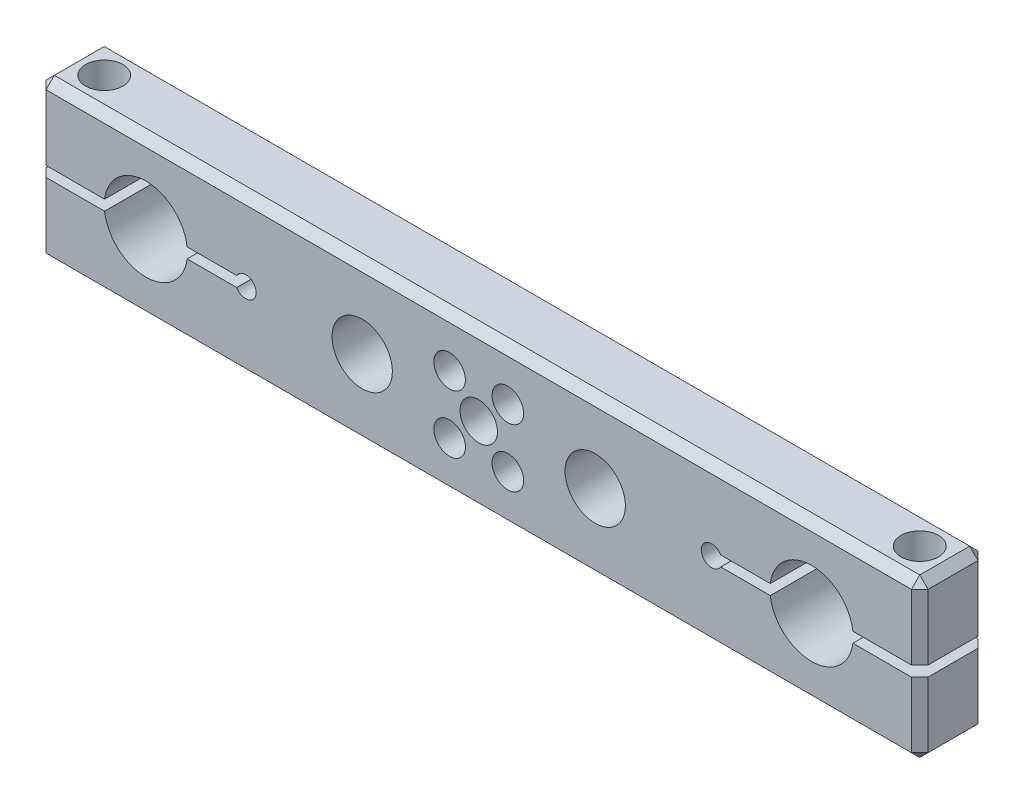
from build123d import *

# Parameters (mm, degrees)
SKETCH_1_W                = 212
SKETCH_1_H                = 38
EXTRUDE_1_DEPTH           = 8
SKETCH_2_R                = 10
CUT_EXTRUDE_1_DEPTH       = 109.87148387
SKETCH_3_W                = 50
SKETCH_3_H                = 2.5
CUT_EXTRUDE_2_DEPTH       = 109.87148387
SKETCH_4_R                = 6
CUT_EXTRUDE_3_DEPTH       = 4
SKETCH_5_R                = 4.5
CUT_EXTRUDE_4_DEPTH       = 109.87148387
HOLE_WIZARD_1_D           = 4.5
HOLE_WIZARD_1_CBORE_D     = 7.6
HOLE_WIZARD_1_CBORE_DEPTH = 10
SKETCH_8_R                = 7.25
CUT_EXTRUDE_5_DEPTH       = 109.87148387
SKETCH_9_R                = 4.5
CUT_EXTRUDE_6_DEPTH       = 17.75
M8X1_25_1_D               = 6.8
CHAMFER_1_SIZE            = 2
SKETCH_13_R               = 2.5
CUT_EXTRUDE_7_DEPTH       = 109.87148387


with BuildPart() as part:
    # 草图1 → 凸台-拉伸1 (new, symmetric)
    with BuildSketch(Plane.XY):
        Rectangle(SKETCH_1_W, SKETCH_1_H)
    extrude(amount=EXTRUDE_1_DEPTH, both=True)

    # 草图2 → 切除-拉伸1 (cut, through all)
    with BuildSketch(Plane.XY.offset(8)):
        with Locations((-80, 0)):
            Circle(SKETCH_2_R)
        with Locations(Location((80, 0, 0), (0, 0, 180))):
            Circle(SKETCH_2_R)
    extrude(amount=-CUT_EXTRUDE_1_DEPTH, mode=Mode.SUBTRACT)

    # 草图3 → 切除-拉伸2 (cut, through all)
    with BuildSketch(Plane.XY.offset(8)):
        with Locations((-81, 0)):
            Rectangle(SKETCH_3_W, SKETCH_3_H)
        with Locations((81, 0)):
            Rectangle(SKETCH_3_W, SKETCH_3_H)
    extrude(amount=-CUT_EXTRUDE_2_DEPTH, mode=Mode.SUBTRACT)

    # 草图4 → 切除-拉伸3 (cut)
    with BuildSketch(Plane.XY.offset(-8)):
        Circle(SKETCH_4_R)
    extrude(amount=CUT_EXTRUDE_3_DEPTH, mode=Mode.SUBTRACT)

    # 草图5 → 切除-拉伸4 (cut, through all)
    with BuildSketch(Plane.XY.offset(8)):
        Circle(SKETCH_5_R)
    extrude(amount=-CUT_EXTRUDE_4_DEPTH, mode=Mode.SUBTRACT)

    # 孔1 (through all)
    with Locations(Plane.XY.offset(8)):
        with Locations((-7, 7), (7, 7), (7, -7), (-7, -7)):
            CounterBoreHole(HOLE_WIZARD_1_D / 2, HOLE_WIZARD_1_CBORE_D / 2, HOLE_WIZARD_1_CBORE_DEPTH)

    # 草图8 → 切除-拉伸5 (cut, through all)
    with BuildSketch(Plane.XY.offset(8)):
        with Locations((-28, 0)):
            Circle(SKETCH_8_R)
        with Locations(Location((28, 0, 0), (0, 0, 180))):
            Circle(SKETCH_8_R)
    extrude(amount=-CUT_EXTRUDE_5_DEPTH, mode=Mode.SUBTRACT)

    # 草图9 → 切除-拉伸6 (cut)
    with BuildSketch(Plane(origin=(0, 19, 0), x_dir=(1, 0, 0), z_dir=(0, 1, 0))):
        with Locations(Location((-98, 0, 0), (0, 0, 270))):
            Circle(SKETCH_9_R)
        with Locations(Location((98, 0, 0), (0, 0, 270))):
            Circle(SKETCH_9_R)
    extrude(amount=-CUT_EXTRUDE_6_DEPTH, mode=Mode.SUBTRACT)

    # M8x1.25 螺纹孔1 (through all)
    with Locations(Plane(origin=(0, -1.25, 0), x_dir=(-1, 0, 0), z_dir=(0, 1, 0))):
        with Locations((98, 0), (-98, 0)):
            Hole(M8X1_25_1_D / 2)

    # 倒角1
    chamfer_1_edges = [part.edges().sort_by_distance(p)[0] for p in [
        (106, -10.125, 8),
        (0, 19, 8),
        (-106, -10.125, -8),
        (-106, -10.125, 8),
        (-106, 10.125, 8),
        (0, 19, -8),
        (106, -10.125, -8),
        (0, -19, -8),
        (106, 10.125, -8),
        (-106, 10.125, -8),
        (106, 10.125, 8),
        (0, -19, 8),
        (-106, 19, 0),
        (106, 19, 0),
        (106, -19, 0),
        (-106, -19, 0),
    ]]
    chamfer(chamfer_1_edges, length=CHAMFER_1_SIZE)

    # 草图13 → 切除-拉伸7 (cut, through all)
    with BuildSketch(Plane.XY.offset(8)):
        with Locations((-56, 0)):
            Circle(SKETCH_13_R)
        with Locations((56, 0)):
            Circle(SKETCH_13_R)
    extrude(amount=-CUT_EXTRUDE_7_DEPTH, mode=Mode.SUBTRACT)


solid = part.part
